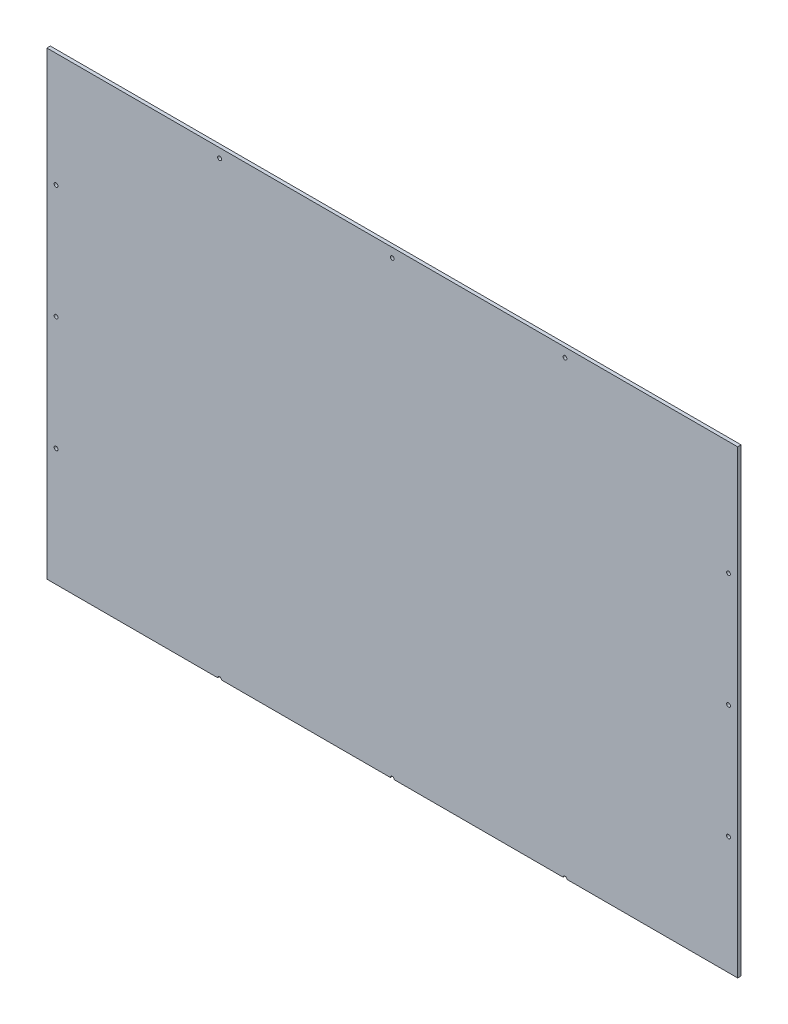
from build123d import *

# Parameters (mm, degrees)
BOSS_EXTRUDE1_DEPTH = 4.5
SKETCH2_R           = 2.5
CUT_EXTRUDE1_DEPTH  = 10


with BuildPart() as part:
    # Sketch1 → Boss-Extrude1 (new body)
    with BuildSketch(Plane.XY):
        with BuildLine():
            Line((-452, 298.5), (452, 298.5))
            Line((452, 298.5), (452, -303.5))
            Line((452, -303.5), (228.5, -303.5))
            ThreePointArc((228.5, -303.5), (226, -301), (223.5, -303.5))
            Line((223.5, -303.5), (2.5, -303.5))
            ThreePointArc((2.5, -303.5), (0, -301), (-2.5, -303.5))
            Line((-2.5, -303.5), (-223.5, -303.5))
            ThreePointArc((-223.5, -303.5), (-226, -301), (-228.5, -303.5))
            Line((-228.5, -303.5), (-452, -303.5))
            Line((-452, -303.5), (-452, 298.5))
        make_face()
    extrude(amount=BOSS_EXTRUDE1_DEPTH)

    # Sketch2 → Cut-Extrude1 (cut)
    with BuildSketch(Plane.XY.offset(4.5)):
        with Locations((0, 286.5)):
            Circle(SKETCH2_R)
        with Locations((440, -149.25)):
            Circle(SKETCH2_R)
        with Locations((440, 0)):
            Circle(SKETCH2_R)
        with Locations((440, 149.25)):
            Circle(SKETCH2_R)
        with Locations((-440, -149.25)):
            Circle(SKETCH2_R)
        with Locations((-440, 0)):
            Circle(SKETCH2_R)
        with Locations((-440, 149.25)):
            Circle(SKETCH2_R)
        with Locations((226, 286.5)):
            Circle(SKETCH2_R)
        with Locations((-226, 286.5)):
            Circle(SKETCH2_R)
    extrude(amount=-CUT_EXTRUDE1_DEPTH, mode=Mode.SUBTRACT)


solid = part.part
